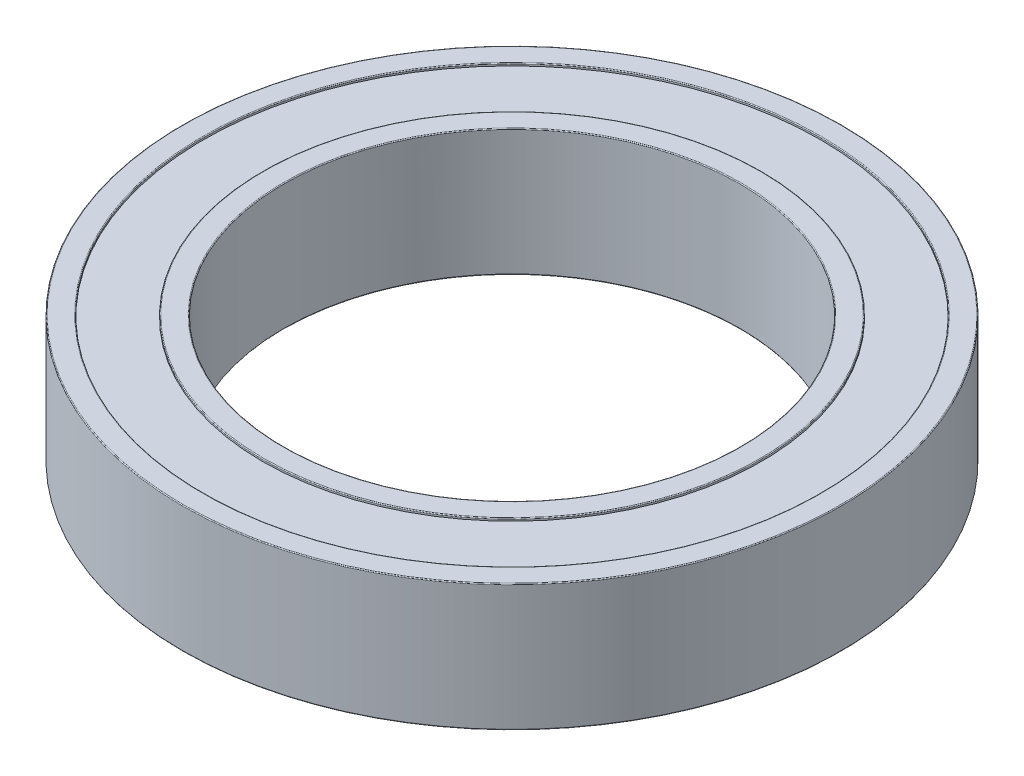
from build123d import *

# Parameters (mm, degrees)
CIRPATTERN1_COUNT = 30
SKETCH3_W         = 4.75
SKETCH3_H         = 0.25
FILLET1_R         = 0.05
FILLET2_R         = 0.05


with BuildPart() as part:
    # Sketch1 → Revolve1 (revolve)
    with BuildSketch(Plane.XY, mode=Mode.PRIVATE) as revolve1_sk:
        with BuildLine():
            Line((-19.5, 3.75), (-18.25, 3.75))
            Line((-18.25, 3.75), (-18.25, 2.5))
            ThreePointArc((-18.25, 2.5), (-19.127501001, 0), (-18.25, -2.5))
            Line((-18.25, -2.5), (-18.25, -3.75))
            Line((-18.25, -3.75), (-19.5, -3.75))
            Line((-19.5, -3.75), (-19.5, 3.75))
        make_face()
        with BuildLine():
            Line((-14.75, -3.75), (-14.75, -2.5))
            ThreePointArc((-14.75, -2.5), (-13.872498999, 0), (-14.75, 2.5))
            Line((-14.75, 2.5), (-14.75, 3.75))
            Line((-14.75, 3.75), (-13.5, 3.75))
            Line((-13.5, 3.75), (-13.5, -3.75))
            Line((-13.5, -3.75), (-14.75, -3.75))
        make_face()
    revolve(revolve1_sk.sketch.rotate(Axis((0, 0, 0), (0, 1, 0)), 270), axis=Axis((0, 0, 0), (0, 1, 0)))

    # Sketch3 → Revolve3 (revolve)
    with BuildSketch(Plane.XY, mode=Mode.PRIVATE) as revolve3_sk:
        with Locations((-15.875, 3.475)):
            Rectangle(SKETCH3_W, SKETCH3_H)
        with Locations((-15.875, -3.475)):
            Rectangle(SKETCH3_W, SKETCH3_H)
    revolve(revolve3_sk.sketch.rotate(Axis((0, 0, 0), (0, 1, 0)), 270), axis=Axis((0, 0, 0), (0, 1, 0)))

    # Fillet1
    fillet1_edges = [part.edges().sort_by_distance(p)[0] for p in [
        (0, -3.75, 19.5),
        (0, -3.75, 18.25),
        (0, 3.75, 18.25),
        (0, 3.75, 19.5),
    ]]
    fillet(fillet1_edges, radius=FILLET1_R)

    # Fillet2
    fillet2_edges = [part.edges().sort_by_distance(p)[0] for p in [
        (0, -3.75, 13.5),
        (0, 3.75, 14.75),
        (0, -3.75, 14.75),
        (0, 3.75, 13.5),
    ]]
    fillet(fillet2_edges, radius=FILLET2_R)


with BuildPart() as body_2:
    # Sketch2 → Revolve2 (revolve)
    with BuildSketch(Plane.XY):
        with BuildLine():
            Line((-16.5, 2.5), (-16.5, -2.5))
            ThreePointArc((-16.5, -2.5), (-19, 0), (-16.5, 2.5))
        make_face()
    revolve2 = revolve(axis=Axis((-16.5, 2.5, 0), (0, -1, 0)))

    # CirPattern1: Revolve2 ×30 about axis
    cirpattern1_axis = Axis((0, 0, 0), (0, 1, 0))
    for i in range(1, CIRPATTERN1_COUNT):
        add(revolve2.rotate(cirpattern1_axis, i * 360 / CIRPATTERN1_COUNT))


solid = Compound([part.part, body_2.part])
